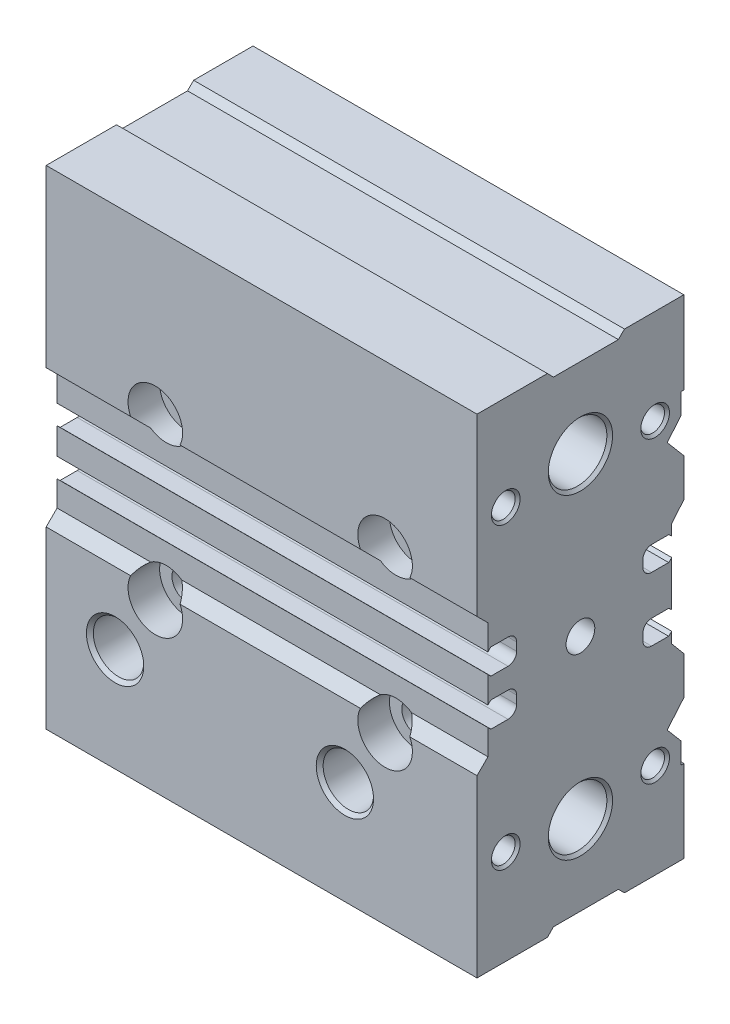
from build123d import *

# Parameters (mm, degrees)
BOSS_EXTRUDE1_DEPTH = 75
SKETCH10_W          = 40
SKETCH10_H          = 5.1


with BuildPart() as part:
    # Sketch1 → Boss-Extrude1 (new body)
    with BuildSketch(Plane(origin=(0, 0, 0), x_dir=(0, 0, -1), z_dir=(1, 0, 0))):
        with BuildLine():
            Line((-18, -42.5), (-5.75, -42.5))
            Line((-5.75, -42.5), (-4.6875, -41.4375))
            Line((-4.6875, -41.4375), (6.604166667, -41.4375))
            Line((6.604166667, -41.4375), (7.666666667, -42.5))
            Line((7.666666667, -42.5), (18, -42.5))
            Line((18, -42.5), (18, -28.152173913))
            Line((18, -28.152173913), (17.5, -28.152173913))
            Line((17.5, -28.152173913), (17.5, -24.5))
            Line((17.5, -24.5), (15.1, -21.666666667))
            Line((15.1, -21.666666667), (18, -18.243055556))
            Line((18, -18.243055556), (18, -11.595935712))
            Line((18, -11.595935712), (15.882352941, -9.072222222))
            Line((15.882352941, -9.072222222), (15.882352941, -7.155555556))
            ThreePointArc((15.882352941, -7.155555556), (15.63583418, -7.424337763), (15.353781513, -7.655555556))
            Line((15.353781513, -7.655555556), (12.382352941, -7.655555556))
            ThreePointArc((12.382352941, -7.655555556), (11.321692769, -7.216215727), (10.882352941, -6.155555556))
            Line((10.882352941, -6.155555556), (10.882352941, -4.955555556))
            ThreePointArc((10.882352941, -4.955555556), (11.321692769, -3.894895384), (12.382352941, -3.455555556))
            Line((12.382352941, -3.455555556), (15.353781513, -3.455555556))
            ThreePointArc((15.353781513, -3.455555556), (15.63583418, -3.686773348), (15.882352941, -3.955555556))
            Line((15.882352941, -3.955555556), (15.882352941, 3.955555556))
            ThreePointArc((15.882352941, 3.955555556), (15.63583418, 3.686773348), (15.353781513, 3.455555556))
            Line((15.353781513, 3.455555556), (12.382352941, 3.455555556))
            ThreePointArc((12.382352941, 3.455555556), (11.321692769, 3.894895384), (10.882352941, 4.955555556))
            Line((10.882352941, 4.955555556), (10.882352941, 6.155555556))
            ThreePointArc((10.882352941, 6.155555556), (11.321692769, 7.216215727), (12.382352941, 7.655555556))
            Line((12.382352941, 7.655555556), (15.353781513, 7.655555556))
            ThreePointArc((15.353781513, 7.655555556), (15.63583418, 7.424337763), (15.882352941, 7.155555556))
            Line((15.882352941, 7.155555556), (15.882352941, 9.072222222))
            Line((15.882352941, 9.072222222), (18, 11.595935712))
            Line((18, 11.595935712), (18, 18.243055556))
            Line((18, 18.243055556), (15.1, 21.666666667))
            Line((15.1, 21.666666667), (17.5, 24.5))
            Line((17.5, 24.5), (17.5, 28.152173913))
            Line((17.5, 28.152173913), (18, 28.152173913))
            Line((18, 28.152173913), (18, 42.5))
            Line((18, 42.5), (7.666666667, 42.5))
            Line((7.666666667, 42.5), (6.604166667, 41.4375))
            Line((6.604166667, 41.4375), (-4.6875, 41.4375))
            Line((-4.6875, 41.4375), (-5.75, 42.5))
            Line((-5.75, 42.5), (-18, 42.5))
            Line((-18, 42.5), (-18, 12))
            Line((-18, 12), (-16.1, 10.1))
            Line((-16.1, 10.1), (-16.1, 5.7))
            ThreePointArc((-16.1, 5.7), (-15.853481239, 5.968782207), (-15.571428571, 6.2))
            Line((-15.571428571, 6.2), (-12.6, 6.2))
            ThreePointArc((-12.6, 6.2), (-11.539339828, 5.760660172), (-11.1, 4.7))
            Line((-11.1, 4.7), (-11.1, 3.3))
            ThreePointArc((-11.1, 3.3), (-11.539339828, 2.239339828), (-12.6, 1.8))
            Line((-12.6, 1.8), (-15.571428571, 1.8))
            ThreePointArc((-15.571428571, 1.8), (-15.853481239, 2.031217793), (-16.1, 2.3))
            Line((-16.1, 2.3), (-16.1, -2.3))
            ThreePointArc((-16.1, -2.3), (-15.853481239, -2.031217793), (-15.571428571, -1.8))
            Line((-15.571428571, -1.8), (-12.6, -1.8))
            ThreePointArc((-12.6, -1.8), (-11.539339828, -2.239339828), (-11.1, -3.3))
            Line((-11.1, -3.3), (-11.1, -4.7))
            ThreePointArc((-11.1, -4.7), (-11.539339828, -5.760660172), (-12.6, -6.2))
            Line((-12.6, -6.2), (-15.571428571, -6.2))
            ThreePointArc((-15.571428571, -6.2), (-15.853481239, -5.968782207), (-16.1, -5.7))
            Line((-16.1, -5.7), (-16.1, -10.1))
            Line((-16.1, -10.1), (-18, -12))
            Line((-18, -12), (-18, -42.5))
        make_face()
    extrude(amount=BOSS_EXTRUDE1_DEPTH)

    # Sketch2 → Cut-Revolve1 (revolve, cut)
    with BuildSketch(Plane.XY, mode=Mode.PRIVATE) as cut_revolve1_sk:
        Polygon((0, 27.5), (0, 33.1), (0.5, 32.6), (74.5, 32.6), (75, 33.1), (75, 27.5), align=None)
    revolve(cut_revolve1_sk.sketch.rotate(Axis((75, 27.5, 0), (-1, 0, 0)), 270), axis=Axis((75, 27.5, 0), (-1, 0, 0)), mode=Mode.SUBTRACT)

    # Sketch3 → Cut-Revolve2 (revolve, cut)
    with BuildSketch(Plane.XY, mode=Mode.PRIVATE) as cut_revolve2_sk:
        Polygon((0, -27.5), (0, -21.9), (0.5, -22.4), (74.5, -22.4), (75, -21.9), (75, -27.5), align=None)
    revolve(cut_revolve2_sk.sketch.rotate(Axis((75, -27.5, 0), (-1, 0, 0)), 270), axis=Axis((75, -27.5, 0), (-1, 0, 0)), mode=Mode.SUBTRACT)

    # Sketch4 → Cut-Revolve3 (revolve, cut)
    with BuildSketch(Plane(origin=(0, 32, 0), x_dir=(-1, 0, 0), z_dir=(0, 1, 0)), mode=Mode.PRIVATE) as cut_revolve3_sk:
        Polygon((-11, -18), (-13.5, -18), (-13.067, -17.567), (-13.067, -10.093383006), (-11, -8.9), align=None)
    revolve(cut_revolve3_sk.sketch.rotate(Axis((11, 32, -8.9), (0, 0, -1)), 180), axis=Axis((11, 32, -8.9), (0, 0, -1)), mode=Mode.SUBTRACT)

    # Sketch5 → Cut-Revolve4 (revolve, cut)
    with BuildSketch(Plane(origin=(0, 32, 0), x_dir=(-1, 0, 0), z_dir=(0, 1, 0)), mode=Mode.PRIVATE) as cut_revolve4_sk:
        Polygon((-61, -18), (-63.5, -18), (-63.067, -17.567), (-63.067, -10.093383006), (-61, -8.9), align=None)
    revolve(cut_revolve4_sk.sketch.rotate(Axis((61, 32, -8.9), (0, 0, -1)), 180), axis=Axis((61, 32, -8.9), (0, 0, -1)), mode=Mode.SUBTRACT)

    # Sketch6 → Cut-Revolve5 (revolve, cut)
    with BuildSketch(Plane(origin=(0, -32, 0), x_dir=(-1, 0, 0), z_dir=(0, 1, 0)), mode=Mode.PRIVATE) as cut_revolve5_sk:
        Polygon((-11, -18), (-13.5, -18), (-13.067, -17.567), (-13.067, -10.093383006), (-11, -8.9), align=None)
    revolve(cut_revolve5_sk.sketch.rotate(Axis((11, -32, -8.9), (0, 0, -1)), 180), axis=Axis((11, -32, -8.9), (0, 0, -1)), mode=Mode.SUBTRACT)

    # Sketch7 → Cut-Revolve6 (revolve, cut)
    with BuildSketch(Plane(origin=(0, -32, 0), x_dir=(-1, 0, 0), z_dir=(0, 1, 0)), mode=Mode.PRIVATE) as cut_revolve6_sk:
        Polygon((-61, -18), (-63.5, -18), (-63.067, -17.567), (-63.067, -10.093383006), (-61, -8.9), align=None)
    revolve(cut_revolve6_sk.sketch.rotate(Axis((61, -32, -8.9), (0, 0, -1)), 180), axis=Axis((61, -32, -8.9), (0, 0, -1)), mode=Mode.SUBTRACT)

    # Sketch8 → Cut-Revolve7 (revolve, cut)
    with BuildSketch(Plane(origin=(0, -24.5, 0), x_dir=(-1, 0, 0), z_dir=(0, 1, 0)), mode=Mode.PRIVATE) as cut_revolve7_sk:
        Polygon((-12, 9.156363636), (-16.131783892, 9.156363636), (-16.389155088, 17.40027692), (-16.988878168, 18), (-12, 18), align=None)
    revolve(cut_revolve7_sk.sketch.rotate(Axis((12, -24.5, 18), (0, 0, -1)), 180), axis=Axis((12, -24.5, 18), (0, 0, -1)), mode=Mode.SUBTRACT)

    # Sketch9 → Cut-Revolve8 (revolve, cut)
    with BuildSketch(Plane(origin=(0, -24.5, 0), x_dir=(-1, 0, 0), z_dir=(0, 1, 0)), mode=Mode.PRIVATE) as cut_revolve8_sk:
        Polygon((-52, 9.156363636), (-56.131783892, 9.156363636), (-56.389155088, 17.40027692), (-56.988878168, 18), (-52, 18), align=None)
    revolve(cut_revolve8_sk.sketch.rotate(Axis((52, -24.5, 18), (0, 0, -1)), 180), axis=Axis((52, -24.5, 18), (0, 0, -1)), mode=Mode.SUBTRACT)

    # Sketch10 → Cut-Revolve9 (revolve, cut)
    with BuildSketch(Plane(origin=(0, 0, 0), x_dir=(-1, 0, 0), z_dir=(0, 1, 0)), mode=Mode.PRIVATE) as cut_revolve9_sk:
        with Locations((-20, -2.55)):
            Rectangle(SKETCH10_W, SKETCH10_H)
    revolve(cut_revolve9_sk.sketch.rotate(Axis((40, 0, 0), (-1, 0, 0)), 180), axis=Axis((40, 0, 0), (-1, 0, 0)), mode=Mode.SUBTRACT)

    # Sketch11 → Cut-Revolve10 (revolve, cut)
    with BuildSketch(Plane(origin=(12, 0, 0), x_dir=(0, 0, -1), z_dir=(1, 0, 0)), mode=Mode.PRIVATE) as cut_revolve10_sk:
        Polygon((-11.5, -33.656363636), (-7.368216108, -33.656363636), (-7.110844912, -41.90027692), (-6.511121832, -42.5), (-11.5, -42.5), align=None)
    revolve(cut_revolve10_sk.sketch.rotate(Axis((12, -42.5, 11.5), (0, 1, 0)), 180), axis=Axis((12, -42.5, 11.5), (0, 1, 0)), mode=Mode.SUBTRACT)

    # Sketch12 → Cut-Revolve11 (revolve, cut)
    with BuildSketch(Plane(origin=(52, 0, 0), x_dir=(0, 0, -1), z_dir=(1, 0, 0)), mode=Mode.PRIVATE) as cut_revolve11_sk:
        Polygon((-11.5, -33.656363636), (-7.368216108, -33.656363636), (-7.110844912, -41.90027692), (-6.511121832, -42.5), (-11.5, -42.5), align=None)
    revolve(cut_revolve11_sk.sketch.rotate(Axis((52, -42.5, 11.5), (0, 1, 0)), 180), axis=Axis((52, -42.5, 11.5), (0, 1, 0)), mode=Mode.SUBTRACT)

    # Sketch13 → Cut-Revolve12 (revolve, cut)
    with BuildSketch(Plane.XY, mode=Mode.PRIVATE) as cut_revolve12_sk:
        Polygon((65.556624327, 0), (67, 2.5), (75, 2.5), (75, 0), align=None)
    revolve(cut_revolve12_sk.sketch.rotate(Axis((75, 0, 0), (-1, 0, 0)), 270), axis=Axis((75, 0, 0), (-1, 0, 0)), mode=Mode.SUBTRACT)

    # Sketch14 → Cut-Revolve13 (revolve, cut)
    with BuildSketch(Plane.XY.offset(-13), mode=Mode.PRIVATE) as cut_revolve13_sk:
        Polygon((58.206616994, 26), (59.4, 28.067), (74.567, 28.067), (75, 28.5), (75, 26), align=None)
    revolve(cut_revolve13_sk.sketch.rotate(Axis((75, 26, -13), (-1, 0, 0)), 270), axis=Axis((75, 26, -13), (-1, 0, 0)), mode=Mode.SUBTRACT)

    # Sketch15 → Cut-Revolve14 (revolve, cut)
    with BuildSketch(Plane.XY.offset(-13), mode=Mode.PRIVATE) as cut_revolve14_sk:
        Polygon((58.206616994, -26), (59.4, -23.933), (74.567, -23.933), (75, -23.5), (75, -26), align=None)
    revolve(cut_revolve14_sk.sketch.rotate(Axis((75, -26, -13), (-1, 0, 0)), 270), axis=Axis((75, -26, -13), (-1, 0, 0)), mode=Mode.SUBTRACT)

    # Sketch16 → Cut-Revolve15 (revolve, cut)
    with BuildSketch(Plane.XY.offset(13), mode=Mode.PRIVATE) as cut_revolve15_sk:
        Polygon((58.206616994, 26), (59.4, 28.067), (74.567, 28.067), (75, 28.5), (75, 26), align=None)
    revolve(cut_revolve15_sk.sketch.rotate(Axis((75, 26, 13), (-1, 0, 0)), 270), axis=Axis((75, 26, 13), (-1, 0, 0)), mode=Mode.SUBTRACT)

    # Sketch17 → Cut-Revolve16 (revolve, cut)
    with BuildSketch(Plane.XY.offset(13), mode=Mode.PRIVATE) as cut_revolve16_sk:
        Polygon((58.206616994, -26), (59.4, -23.933), (74.567, -23.933), (75, -23.5), (75, -26), align=None)
    revolve(cut_revolve16_sk.sketch.rotate(Axis((75, -26, 13), (-1, 0, 0)), 270), axis=Axis((75, -26, 13), (-1, 0, 0)), mode=Mode.SUBTRACT)

    # Sketch18 → Cut-Revolve17 (revolve, cut)
    with BuildSketch(Plane(origin=(19, 0, 0), x_dir=(0, 0, -1), z_dir=(1, 0, 0)), mode=Mode.PRIVATE) as cut_revolve17_sk:
        Polygon((-18, 14), (-18, 18.75), (-12.5, 18.75), (-12.5, 16.6), (5.307179677, 16.6), (5.307179677, 16.4585), (17.4585, 16.4585), (18, 17), (18, 14), align=None)
    revolve(cut_revolve17_sk.sketch.rotate(Axis((19, 14, -18), (0, 0, 1)), 270), axis=Axis((19, 14, -18), (0, 0, 1)), mode=Mode.SUBTRACT)

    # Sketch19 → Cut-Revolve18 (revolve, cut)
    with BuildSketch(Plane(origin=(19, 0, 0), x_dir=(0, 0, -1), z_dir=(1, 0, 0)), mode=Mode.PRIVATE) as cut_revolve18_sk:
        Polygon((-18, -14), (-18, -9.25), (-12.5, -9.25), (-12.5, -11.4), (5.307179677, -11.4), (5.307179677, -11.5415), (17.4585, -11.5415), (18, -11), (18, -14), align=None)
    revolve(cut_revolve18_sk.sketch.rotate(Axis((19, -14, -18), (0, 0, 1)), 270), axis=Axis((19, -14, -18), (0, 0, 1)), mode=Mode.SUBTRACT)

    # Sketch20 → Cut-Revolve19 (revolve, cut)
    with BuildSketch(Plane(origin=(59, 0, 0), x_dir=(0, 0, -1), z_dir=(1, 0, 0)), mode=Mode.PRIVATE) as cut_revolve19_sk:
        Polygon((-18, -14), (-18, -9.25), (-12.5, -9.25), (-12.5, -11.4), (5.307179677, -11.4), (5.307179677, -11.5415), (17.4585, -11.5415), (18, -11), (18, -14), align=None)
    revolve(cut_revolve19_sk.sketch.rotate(Axis((59, -14, -18), (0, 0, 1)), 270), axis=Axis((59, -14, -18), (0, 0, 1)), mode=Mode.SUBTRACT)

    # Sketch21 → Cut-Revolve20 (revolve, cut)
    with BuildSketch(Plane(origin=(59, 0, 0), x_dir=(0, 0, -1), z_dir=(1, 0, 0)), mode=Mode.PRIVATE) as cut_revolve20_sk:
        Polygon((-18, 14), (-18, 18.75), (-12.5, 18.75), (-12.5, 16.6), (5.307179677, 16.6), (5.307179677, 16.4585), (17.4585, 16.4585), (18, 17), (18, 14), align=None)
    revolve(cut_revolve20_sk.sketch.rotate(Axis((59, 14, -18), (0, 0, 1)), 270), axis=Axis((59, 14, -18), (0, 0, 1)), mode=Mode.SUBTRACT)


solid = part.part
